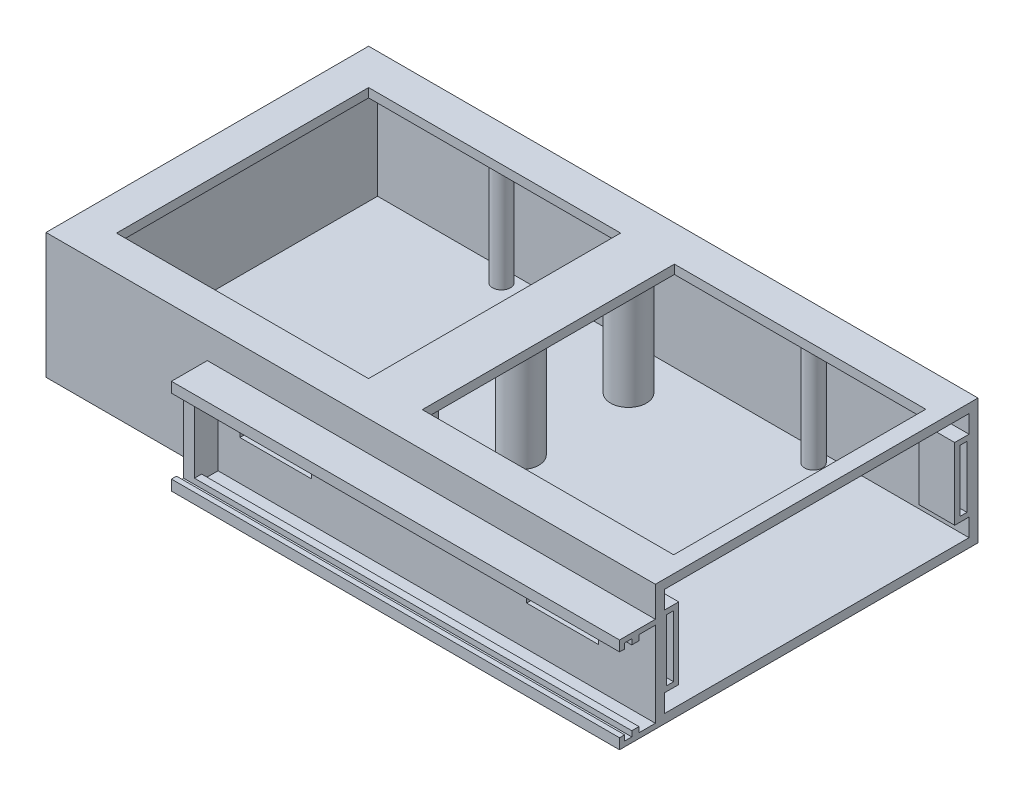
from build123d import *

# Parameters (mm, degrees)
SKETCH_1_W               = 170
SKETCH_1_H               = 90
EXTRUDE_1_DEPTH          = 35
SKETCH_2_W               = 85
SKETCH_2_H               = 30
CUT_EXTRUDE_1_DEPTH      = 165
SKETCH_3_W               = 70.129701139
SKETCH_3_H               = 70.327043484
SKETCH_3_W_2             = 70.299701721
CUT_EXTRUDE_2_DEPTH      = 10
SKETCH_7_W               = 20
SKETCH_7_H               = 10
CUT_EXTRUDE_3_DEPTH      = 10
EXTRUDE_2_DEPTH          = 85
EXTRUDE_2_DEPTH_BACK     = 40
SKETCH_8_W               = 10
SKETCH_8_H               = 26.54076927
SKETCH_9_W               = 8.585786438
SKETCH_9_H               = 23.712342146
CUT_EXTRUDE_4_DEPTH      = 122
CUT_EXTRUDE_5_DEPTH      = 122
SKETCH_11_W              = 2
SKETCH_11_H              = 1.496455469
SKETCH_11_H_2            = 1.5
EXTRUDE_3_DEPTH          = 122
SKETCH_13_W              = 4
SKETCH_13_H              = 20
EXTRUDE_4_DEPTH          = 10
SKETCH_14_W              = 2
SKETCH_14_H              = 17.171572876
CUT_EXTRUDE_6_DEPTH      = 5
CUT_EXTRUDE_7_DEPTH      = 139.325702601
CUT_EXTRUDE_7_DEPTH_BACK = 5
SKETCH_16_R              = 2.5
SKETCH_16_R_2            = 5
EXTRUDE_5_DEPTH          = 32


with BuildPart() as part:
    # Эскиз1 → Бобышка-Вытянуть1 (new body)
    with BuildSketch(Plane(origin=(0, 0, 0), x_dir=(1, 0, 0), z_dir=(0, 1, 0))):
        Rectangle(SKETCH_1_W, SKETCH_1_H)
    extrude(amount=EXTRUDE_1_DEPTH)

    # Эскиз2 → Вырез-Вытянуть1 (cut)
    with BuildSketch(Plane(origin=(85, 0, 0), x_dir=(0, 0, -1), z_dir=(1, 0, 0))):
        with Locations((0, 17.5)):
            Rectangle(SKETCH_2_W, SKETCH_2_H)
    extrude(amount=-CUT_EXTRUDE_1_DEPTH, mode=Mode.SUBTRACT)

    # Эскиз3 → Вырез-Вытянуть2 (cut)
    with BuildSketch(Plane(origin=(0, 35, 0), x_dir=(1, 0, 0), z_dir=(0, 1, 0))):
        with Locations((45.364552291, -0.163521742)):
            Rectangle(SKETCH_3_W, SKETCH_3_H)
        with Locations((-39.850149139, -0.163521742)):
            Rectangle(SKETCH_3_W_2, SKETCH_3_H)
    extrude(amount=-CUT_EXTRUDE_2_DEPTH, mode=Mode.SUBTRACT)

    # Эскиз7 → Вырез-Вытянуть3 (cut)
    with BuildSketch(Plane.XY.offset(45)):
        with Locations((59.089377198, 17.5)):
            Rectangle(SKETCH_7_W, SKETCH_7_H)
        with Locations((-20.910622802, 17.5)):
            Rectangle(SKETCH_7_W, SKETCH_7_H)
    extrude(amount=-CUT_EXTRUDE_3_DEPTH, mode=Mode.SUBTRACT)

    # Эскиз8 → Бобышка-Вытянуть2 (add, two sides: drawn at the far end of the back side and taken through both)
    with BuildSketch(Plane(origin=(0, 0, 0), x_dir=(0, 0, -1), z_dir=(1, 0, 0)).offset(-EXTRUDE_2_DEPTH_BACK)):
        with Locations((-50, 13.270384635)):
            Rectangle(SKETCH_8_W, SKETCH_8_H)
    extrude(amount=EXTRUDE_2_DEPTH + EXTRUDE_2_DEPTH_BACK)

    # Эскиз9 → Вырез-Вытянуть4 (cut)
    with BuildSketch(Plane(origin=(85, 0, 0), x_dir=(0, 0, -1), z_dir=(1, 0, 0))):
        with Locations((-49.292893219, 13.270384635)):
            Rectangle(SKETCH_9_W, SKETCH_9_H)
    extrude(amount=-CUT_EXTRUDE_4_DEPTH, mode=Mode.SUBTRACT)

    # Эскиз10 → Вырез-Вытянуть5 (cut)
    with BuildSketch(Plane(origin=(85, 0, 0), x_dir=(0, 0, -1), z_dir=(1, 0, 0))):
        Polygon((-53.585786438, 2.914213562), (-57.191351612, 2.914213562), (-57.191351612, 23.710872093), (-53.585786438, 23.630100239), align=None)
    extrude(amount=-CUT_EXTRUDE_5_DEPTH, mode=Mode.SUBTRACT)

    # Эскиз11 → Бобышка-Вытянуть3 (add)
    with BuildSketch(Plane(origin=(85, 0, 0), x_dir=(0, 0, -1), z_dir=(1, 0, 0))):
        with Locations((-50.585786438, 24.378327973)):
            Rectangle(SKETCH_11_W, SKETCH_11_H)
        with Locations((-50.585786438, 2.164213562)):
            Rectangle(SKETCH_11_W, SKETCH_11_H_2)
    extrude(amount=-EXTRUDE_3_DEPTH)

    # Эскиз13 → Бобышка-Вытянуть4 (add)
    with BuildSketch(Plane(origin=(85, 0, 0), x_dir=(0, 0, -1), z_dir=(1, 0, 0))):
        with Locations((40.5, 17.5)):
            Rectangle(SKETCH_13_W, SKETCH_13_H)
        with Locations((-40.5, 17.5)):
            Rectangle(SKETCH_13_W, SKETCH_13_H)
    extrude(amount=-EXTRUDE_4_DEPTH)

    # Эскиз14 → Вырез-Вытянуть6 (cut)
    with BuildSketch(Plane(origin=(85, 0, 0), x_dir=(0, 0, -1), z_dir=(1, 0, 0))):
        with Locations((-40.914213562, 17.5)):
            Rectangle(SKETCH_14_W, SKETCH_14_H)
        with Locations((40.914213562, 17.5)):
            Rectangle(SKETCH_14_W, SKETCH_14_H)
    extrude(amount=-CUT_EXTRUDE_6_DEPTH, mode=Mode.SUBTRACT)

    # Эскиз15 → Вырез-Вытянуть7 (cut, two sides: drawn at the far end of the back side and taken through both)
    with BuildSketch(Plane(origin=(-37, 0, 0), x_dir=(0, 0, -1), z_dir=(1, 0, 0)).offset(-CUT_EXTRUDE_7_DEPTH_BACK)):
        Polygon((-55, 23.661781445), (-53.585786438, 23.630100239), (-53.585786438, 25.126555708), (-51.585786438, 25.126555708), (-51.585786438, 1.414213562), (-53.585786438, 1.414213562), (-53.585786438, 2.914213562), (-55, 2.914213562), (-57.035298645, 2.914213562), (-57.035298645, 23.645940842), align=None)
    extrude(amount=CUT_EXTRUDE_7_DEPTH + CUT_EXTRUDE_7_DEPTH_BACK, mode=Mode.SUBTRACT)

    # Эскиз16 → Бобышка-Вытянуть5 (add)
    with BuildSketch(Plane(origin=(0, 2.5, 0), x_dir=(1, 0, 0), z_dir=(0, 1, 0))):
        with Locations(Location((-41.821245604, 38.912307884, 0), (0, 0, 90))):
            Circle(SKETCH_16_R)
        with Locations(Location((-41.821245604, -38.979762053, 0), (0, 0, 90))):
            Circle(SKETCH_16_R)
        with Locations(Location((2.5, 0, 0), (0, 0, 90))):
            Circle(SKETCH_16_R_2)
        with Locations(Location((45.226425125, 38.912307884, 0), (0, 0, 90))):
            Circle(SKETCH_16_R)
        with Locations(Location((45.226425125, -39.333951436, 0), (0, 0, 90))):
            Circle(SKETCH_16_R)
        with Locations(Location((2.5, 30, 0), (0, 0, 90))):
            Circle(SKETCH_16_R_2)
        with Locations(Location((2.5, -30, 0), (0, 0, 90))):
            Circle(SKETCH_16_R_2)
    extrude(amount=EXTRUDE_5_DEPTH)


solid = part.part
